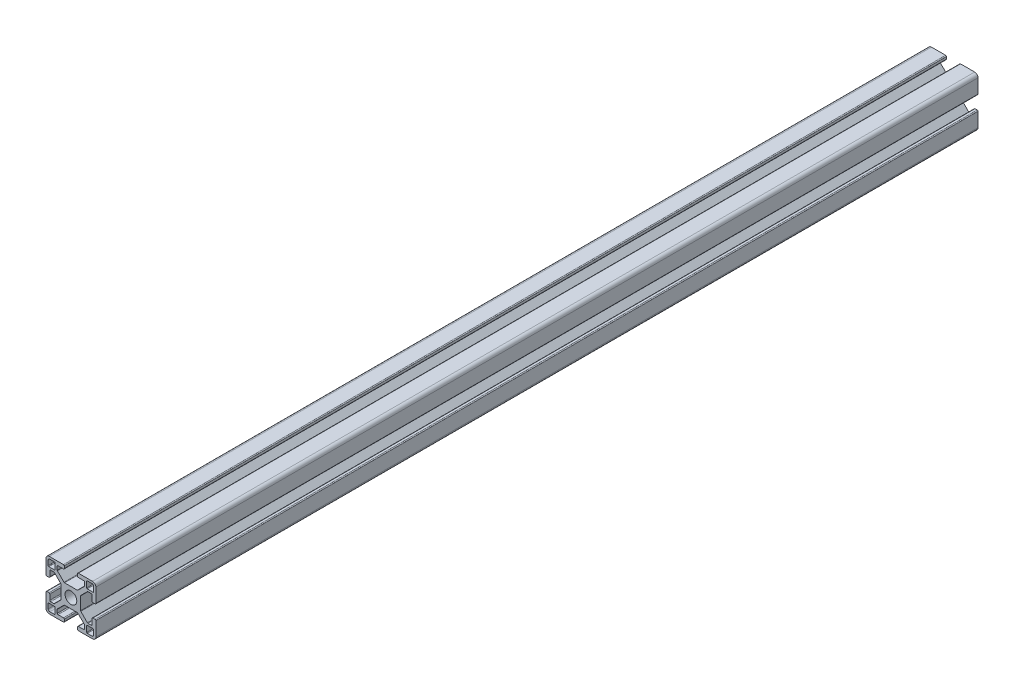
from build123d import *

# Parameters (mm, degrees)
SKETCH1_R           = 3.52998588
BOSS_EXTRUDE1_DEPTH = 265.511026


with BuildPart() as part:
    # Sketch1 → Boss-Extrude1 (new, symmetric)
    with BuildSketch(Plane.XY):
        with BuildLine():
            Line((14.49994, -4), (13.24247465, -4))
            ThreePointArc((13.24247465, -4), (12.88892126, -4.146446609), (12.74247465, -4.5))
            Line((12.74247465, -4.5), (12.74247465, -7.732519321))
            ThreePointArc((12.74247465, -7.732519321), (12.602449697, -8.097296796), (12.242781236, -8.249967))
            Line((12.242781236, -8.249967), (10.260188032, -8.249967))
            ThreePointArc((10.260188032, -8.249967), (10.068847082, -8.211906919), (9.906636056, -8.103520976))
            Line((9.906636056, -8.103520976), (5.981117769, -4.178002689))
            ThreePointArc((5.981117769, -4.178002689), (5.872731827, -4.015791664), (5.834671745, -3.824450713))
            Line((5.834671745, -3.824450713), (5.834671745, -1.01249595))
            Line((5.834671745, -1.01249595), (5.834671745, 0.88749645))
            Line((5.834671745, 0.88749645), (5.834671745, 3.824450713))
            ThreePointArc((5.834671745, 3.824450713), (5.872731827, 4.015791664), (5.981117769, 4.178002689))
            Line((5.981117769, 4.178002689), (9.906636056, 8.103520976))
            ThreePointArc((9.906636056, 8.103520976), (10.068847082, 8.211906919), (10.260188032, 8.249967))
            Line((10.260188032, 8.249967), (12.242781236, 8.249967))
            ThreePointArc((12.242781236, 8.249967), (12.602449697, 8.097296796), (12.74247465, 7.732519321))
            Line((12.74247465, 7.732519321), (12.74247465, 4.5))
            ThreePointArc((12.74247465, 4.5), (12.88892126, 4.146446609), (13.24247465, 4))
            Line((13.24247465, 4), (14.49994, 4))
            ThreePointArc((14.49994, 4), (14.853493391, 4.146446609), (14.99994, 4.5))
            Line((14.99994, 4.5), (14.99994, 12.999948))
            ThreePointArc((14.99994, 12.999948), (14.414155906, 14.414155906), (12.999948, 14.99994))
            Line((12.999948, 14.99994), (4.5, 14.99994))
            ThreePointArc((4.5, 14.99994), (4.146446609, 14.853493391), (4, 14.49994))
            Line((4, 14.49994), (4, 13.24247465))
            ThreePointArc((4, 13.24247465), (4.146446609, 12.88892126), (4.5, 12.74247465))
            Line((4.5, 12.74247465), (7.732519321, 12.74247465))
            ThreePointArc((7.732519321, 12.74247465), (8.097296796, 12.602449697), (8.249967, 12.242781236))
            Line((8.249967, 12.242781236), (8.249967, 10.260188032))
            ThreePointArc((8.249967, 10.260188032), (8.211906919, 10.068847082), (8.103520976, 9.906636056))
            Line((8.103520976, 9.906636056), (4.178002689, 5.981117769))
            ThreePointArc((4.178002689, 5.981117769), (4.015791664, 5.872731827), (3.824450713, 5.834671745))
            Line((3.824450713, 5.834671745), (0.9499962, 5.834671745))
            Line((0.9499962, 5.834671745), (-0.9499962, 5.834671745))
            Line((-0.9499962, 5.834671745), (-3.824450713, 5.834671745))
            ThreePointArc((-3.824450713, 5.834671745), (-4.015791664, 5.872731827), (-4.178002689, 5.981117769))
            Line((-4.178002689, 5.981117769), (-8.103520976, 9.906636056))
            ThreePointArc((-8.103520976, 9.906636056), (-8.211906919, 10.068847082), (-8.249967, 10.260188032))
            Line((-8.249967, 10.260188032), (-8.249967, 12.242781236))
            ThreePointArc((-8.249967, 12.242781236), (-8.097296796, 12.602449697), (-7.732519321, 12.74247465))
            Line((-7.732519321, 12.74247465), (-4.5, 12.74247465))
            ThreePointArc((-4.5, 12.74247465), (-4.146446609, 12.88892126), (-4, 13.24247465))
            Line((-4, 13.24247465), (-4, 14.49994))
            ThreePointArc((-4, 14.49994), (-4.146446609, 14.853493391), (-4.5, 14.99994))
            Line((-4.5, 14.99994), (-12.999948, 14.99994))
            ThreePointArc((-12.999948, 14.99994), (-14.414155906, 14.414155906), (-14.99994, 12.999948))
            Line((-14.99994, 12.999948), (-14.99994, 4.5))
            ThreePointArc((-14.99994, 4.5), (-14.853493391, 4.146446609), (-14.49994, 4))
            Line((-14.49994, 4), (-13.24247465, 4))
            ThreePointArc((-13.24247465, 4), (-12.88892126, 4.146446609), (-12.74247465, 4.5))
            Line((-12.74247465, 4.5), (-12.74247465, 7.732519321))
            ThreePointArc((-12.74247465, 7.732519321), (-12.602449697, 8.097296796), (-12.242781236, 8.249967))
            Line((-12.242781236, 8.249967), (-10.260188032, 8.249967))
            ThreePointArc((-10.260188032, 8.249967), (-10.068847082, 8.211906919), (-9.906636056, 8.103520976))
            Line((-9.906636056, 8.103520976), (-5.981117769, 4.178002689))
            ThreePointArc((-5.981117769, 4.178002689), (-5.872731827, 4.015791664), (-5.834671745, 3.824450713))
            Line((-5.834671745, 3.824450713), (-5.834671745, 0.88749645))
            Line((-5.834671745, 0.88749645), (-5.834671745, -1.01249595))
            Line((-5.834671745, -1.01249595), (-5.834671745, -3.824450713))
            ThreePointArc((-5.834671745, -3.824450713), (-5.872731827, -4.015791664), (-5.981117769, -4.178002689))
            Line((-5.981117769, -4.178002689), (-9.906636056, -8.103520976))
            ThreePointArc((-9.906636056, -8.103520976), (-10.068847082, -8.211906919), (-10.260188032, -8.249967))
            Line((-10.260188032, -8.249967), (-12.242781236, -8.249967))
            ThreePointArc((-12.242781236, -8.249967), (-12.602449697, -8.097296796), (-12.74247465, -7.732519321))
            Line((-12.74247465, -7.732519321), (-12.74247465, -4.5))
            ThreePointArc((-12.74247465, -4.5), (-12.88892126, -4.146446609), (-13.24247465, -4))
            Line((-13.24247465, -4), (-14.49994, -4))
            ThreePointArc((-14.49994, -4), (-14.853493391, -4.146446609), (-14.99994, -4.5))
            Line((-14.99994, -4.5), (-14.99994, -12.999948))
            ThreePointArc((-14.99994, -12.999948), (-14.414155906, -14.414155906), (-12.999948, -14.99994))
            Line((-12.999948, -14.99994), (-4.5, -14.99994))
            ThreePointArc((-4.5, -14.99994), (-4.146446609, -14.853493391), (-4, -14.49994))
            Line((-4, -14.49994), (-4, -13.24247465))
            ThreePointArc((-4, -13.24247465), (-4.146446609, -12.88892126), (-4.5, -12.74247465))
            Line((-4.5, -12.74247465), (-7.732519321, -12.74247465))
            ThreePointArc((-7.732519321, -12.74247465), (-8.097296796, -12.602449697), (-8.249967, -12.242781236))
            Line((-8.249967, -12.242781236), (-8.249967, -10.260188032))
            ThreePointArc((-8.249967, -10.260188032), (-8.211906919, -10.068847082), (-8.103520976, -9.906636056))
            Line((-8.103520976, -9.906636056), (-4.178002689, -5.981117769))
            ThreePointArc((-4.178002689, -5.981117769), (-4.015791664, -5.872731827), (-3.824450713, -5.834671745))
            Line((-3.824450713, -5.834671745), (-0.9499962, -5.834671745))
            Line((-0.9499962, -5.834671745), (0.9499962, -5.834671745))
            Line((0.9499962, -5.834671745), (3.824450713, -5.834671745))
            ThreePointArc((3.824450713, -5.834671745), (4.015791664, -5.872731827), (4.178002689, -5.981117769))
            Line((4.178002689, -5.981117769), (8.103520976, -9.906636056))
            ThreePointArc((8.103520976, -9.906636056), (8.211906919, -10.068847082), (8.249967, -10.260188032))
            Line((8.249967, -10.260188032), (8.249967, -12.242781236))
            ThreePointArc((8.249967, -12.242781236), (8.097296796, -12.602449697), (7.732519321, -12.74247465))
            Line((7.732519321, -12.74247465), (4.5, -12.74247465))
            ThreePointArc((4.5, -12.74247465), (4.146446609, -12.88892126), (4, -13.24247465))
            Line((4, -13.24247465), (4, -14.49994))
            ThreePointArc((4, -14.49994), (4.146446609, -14.853493391), (4.5, -14.99994))
            Line((4.5, -14.99994), (12.999948, -14.99994))
            ThreePointArc((12.999948, -14.99994), (14.414155906, -14.414155906), (14.99994, -12.999948))
            Line((14.99994, -12.999948), (14.99994, -4.5))
            ThreePointArc((14.99994, -4.5), (14.853493391, -4.146446609), (14.49994, -4))
        make_face()
        Circle(SKETCH1_R, mode=Mode.SUBTRACT)
        with BuildLine():
            Line((-12.6999492, -13.6999452), (-9.880960476, -13.6999452))
            ThreePointArc((-9.880960476, -13.6999452), (-9.61155387, -13.58835333), (-9.499962, -13.318946724))
            Line((-9.499962, -13.318946724), (-9.499962, -9.87996048))
            ThreePointArc((-9.499962, -9.87996048), (-9.611260978, -9.611260978), (-9.87996048, -9.499962))
            Line((-9.87996048, -9.499962), (-13.318946724, -9.499962))
            ThreePointArc((-13.318946724, -9.499962), (-13.58835333, -9.61155387), (-13.6999452, -9.880960476))
            Line((-13.6999452, -9.880960476), (-13.6999452, -12.6999492))
            ThreePointArc((-13.6999452, -12.6999492), (-13.407053153, -13.407053153), (-12.6999492, -13.6999452))
        make_face(mode=Mode.SUBTRACT)
        with BuildLine():
            Line((13.6999452, -12.6999492), (13.6999452, -9.880960476))
            ThreePointArc((13.6999452, -9.880960476), (13.58835333, -9.61155387), (13.318946724, -9.499962))
            Line((13.318946724, -9.499962), (9.87996048, -9.499962))
            ThreePointArc((9.87996048, -9.499962), (9.611260978, -9.611260978), (9.499962, -9.87996048))
            Line((9.499962, -9.87996048), (9.499962, -13.318946724))
            ThreePointArc((9.499962, -13.318946724), (9.61155387, -13.58835333), (9.880960476, -13.6999452))
            Line((9.880960476, -13.6999452), (12.6999492, -13.6999452))
            ThreePointArc((12.6999492, -13.6999452), (13.407053153, -13.407053153), (13.6999452, -12.6999492))
        make_face(mode=Mode.SUBTRACT)
        with BuildLine():
            Line((9.87996048, 9.499962), (13.318946724, 9.499962))
            ThreePointArc((13.318946724, 9.499962), (13.58835333, 9.61155387), (13.6999452, 9.880960476))
            Line((13.6999452, 9.880960476), (13.6999452, 12.6999492))
            ThreePointArc((13.6999452, 12.6999492), (13.407053153, 13.407053153), (12.6999492, 13.6999452))
            Line((12.6999492, 13.6999452), (9.880960476, 13.6999452))
            ThreePointArc((9.880960476, 13.6999452), (9.61155387, 13.58835333), (9.499962, 13.318946724))
            Line((9.499962, 13.318946724), (9.499962, 9.87996048))
            ThreePointArc((9.499962, 9.87996048), (9.611260978, 9.611260978), (9.87996048, 9.499962))
        make_face(mode=Mode.SUBTRACT)
        with BuildLine():
            Line((-13.6999452, 12.6999492), (-13.6999452, 9.880960476))
            ThreePointArc((-13.6999452, 9.880960476), (-13.58835333, 9.61155387), (-13.318946724, 9.499962))
            Line((-13.318946724, 9.499962), (-9.87996048, 9.499962))
            ThreePointArc((-9.87996048, 9.499962), (-9.611260978, 9.611260978), (-9.499962, 9.87996048))
            Line((-9.499962, 9.87996048), (-9.499962, 13.318946724))
            ThreePointArc((-9.499962, 13.318946724), (-9.61155387, 13.58835333), (-9.880960476, 13.6999452))
            Line((-9.880960476, 13.6999452), (-12.6999492, 13.6999452))
            ThreePointArc((-12.6999492, 13.6999452), (-13.407053153, 13.407053153), (-13.6999452, 12.6999492))
        make_face(mode=Mode.SUBTRACT)
    extrude(amount=BOSS_EXTRUDE1_DEPTH, both=True)


solid = part.part
